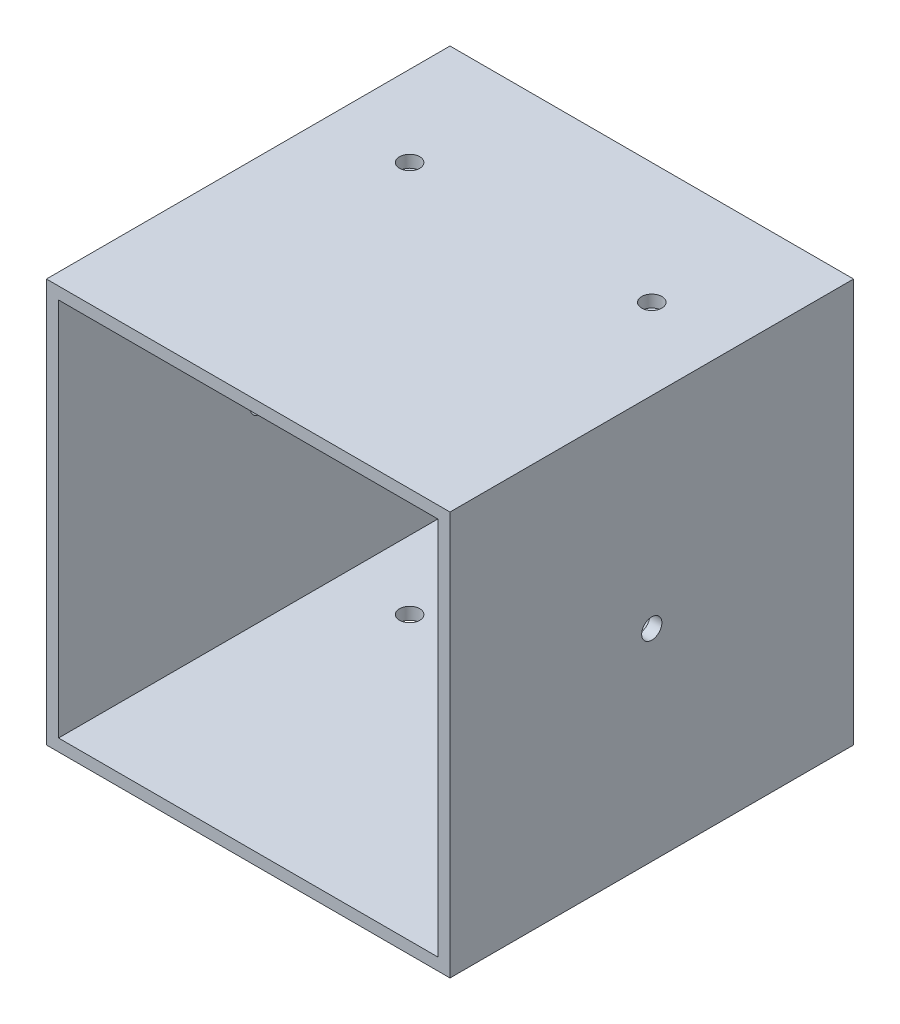
from build123d import *

# Parameters (mm, degrees)
SKETCH_1_W          = 100
SKETCH_1_H          = 100
SKETCH_1_W_2        = 94
SKETCH_1_H_2        = 94
EXTRUDE_1_DEPTH     = 50
EXTRUDE_2_REACH     = 122.037
SKETCH_4_W          = 66
SKETCH_4_H          = 3
SKETCH_2_R          = 2.5
CUT_EXTRUDE_1_DEPTH = 50
SKETCH_9_R          = 2.5
CUT_EXTRUDE_5_DEPTH = 123.474487139
SKETCH_10_R         = 2.5
CUT_EXTRUDE_6_DEPTH = 20


with BuildPart() as part:
    # 草圖1 → 填料-伸長1 (new, symmetric)
    with BuildSketch(Plane.XY):
        Rectangle(SKETCH_1_W, SKETCH_1_H)
        Rectangle(SKETCH_1_W_2, SKETCH_1_H_2, mode=Mode.SUBTRACT)
    extrude(amount=EXTRUDE_1_DEPTH, both=True)

    # 草圖4 → 填料-伸長2 (add, up to next)
    with BuildSketch(Plane(origin=(-47, 0, 0), x_dir=(0, 0, -1), z_dir=(1, 0, 0)), mode=Mode.PRIVATE) as extrude_2_sk1:
        with Locations((0, 38.5)):
            Rectangle(SKETCH_4_W, SKETCH_4_H)
    extrude_2_tool1 = extrude(extrude_2_sk1.sketch, amount=EXTRUDE_2_REACH, mode=Mode.PRIVATE) - part.part
    add(extrude_2_tool1.solids().sort_by_distance((-47, 38.5, 0))[0])

    # 草圖2 → 除料-伸長1 (cut, symmetric)
    with BuildSketch(Plane(origin=(0, 0, 0), x_dir=(0, 0, -1), z_dir=(1, 0, 0))):
        Circle(SKETCH_2_R)
    extrude(amount=CUT_EXTRUDE_1_DEPTH, both=True, mode=Mode.SUBTRACT)

    # 草圖9 → 除料-伸長5 (cut, through all)
    with BuildSketch(Plane(origin=(0, 50, 0), x_dir=(1, 0, 0), z_dir=(0, 1, 0))):
        with Locations(Location((-30, 20, 0), (0, 0, 270))):
            Circle(SKETCH_9_R)
        with Locations(Location((30, 20, 0), (0, 0, 270))):
            Circle(SKETCH_9_R)
    extrude(amount=-CUT_EXTRUDE_5_DEPTH, mode=Mode.SUBTRACT)

    # 草圖10 → 除料-伸長6 (cut)
    with BuildSketch(Plane(origin=(0, 40, 0), x_dir=(1, 0, 0), z_dir=(0, 1, 0))):
        with Locations(Location((-30, 0, 0), (0, 0, 270))):
            Circle(SKETCH_10_R)
        with Locations(Location((30, 0, 0), (0, 0, 270))):
            Circle(SKETCH_10_R)
    extrude(amount=-CUT_EXTRUDE_6_DEPTH, mode=Mode.SUBTRACT)


solid = part.part
